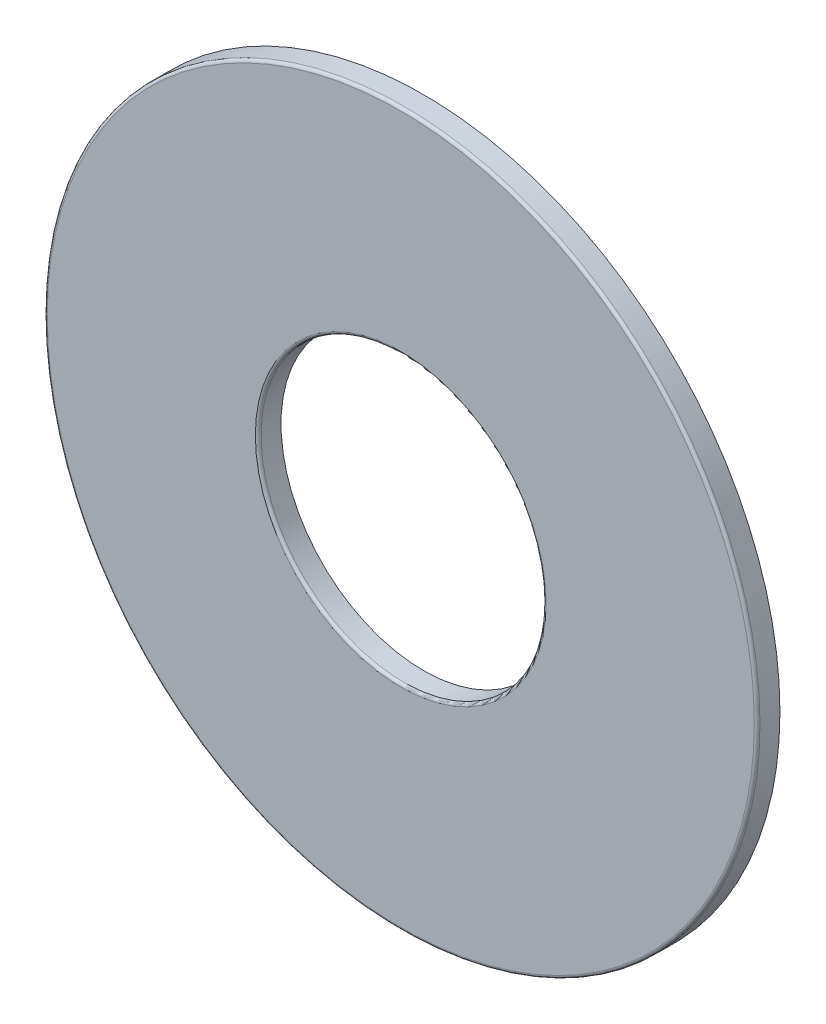
from build123d import *

# Parameters (mm, degrees)
SKETCH1_R           = 12.5
SKETCH1_R_2         = 5
BOSS_EXTRUDE1_DEPTH = 0.8
FILLET1_R           = 0.1


with BuildPart() as part:
    # Sketch1 → Boss-Extrude1 (new body)
    with BuildSketch(Plane.XY):
        Circle(SKETCH1_R)
        Circle(SKETCH1_R_2, mode=Mode.SUBTRACT)
    extrude(amount=BOSS_EXTRUDE1_DEPTH)

    # Fillet1
    fillet1_edges = [part.edges().sort_by_distance(p)[0] for p in [
        (-12.5, 0, 0.8),
        (-5, 0, 0.8),
    ]]
    fillet(fillet1_edges, radius=FILLET1_R)


solid = part.part
